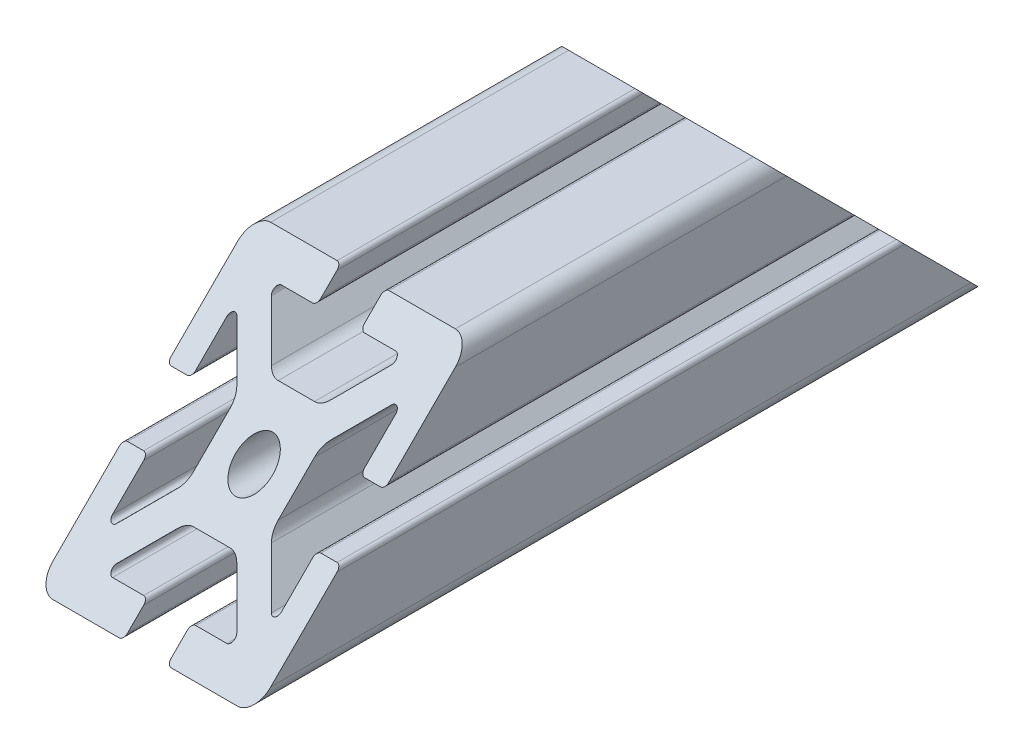
from build123d import *

# Parameters (mm, degrees)
SKETCH1_R          = 3.4036
EXTRUDE1_DEPTH     = 1219.2
CUT_EXTRUDE1_DEPTH = 1221.019934263


with BuildPart() as part:
    # Sketch1 → Extrude1 (new, symmetric)
    with BuildSketch(Plane.XY):
        with BuildLine():
            Line((-20, 16.952), (-20, 4.7625))
            ThreePointArc((-20, 4.7625), (-19.776815367, 4.223684633), (-19.238, 4.0005))
            Line((-19.238, 4.0005), (-16.2662, 4.0005))
            ThreePointArc((-16.2662, 4.0005), (-15.727384633, 4.223684633), (-15.5042, 4.7625))
            Line((-15.5042, 4.7625), (-15.5042, 10.485558599))
            ThreePointArc((-15.5042, 10.485558599), (-15.033804775, 11.189554802), (-14.203384633, 11.024373966))
            Line((-14.203384633, 11.024373966), (-8.635059555, 5.456048889))
            ThreePointArc((-8.635059555, 5.456048889), (-7.985348265, 4.483687227), (-7.7572, 3.336708444))
            Line((-7.7572, 3.336708444), (-7.7572, -3.336708444))
            ThreePointArc((-7.7572, -3.336708444), (-7.985348265, -4.483687227), (-8.635059555, -5.456048889))
            Line((-8.635059555, -5.456048889), (-14.203384633, -11.024373966))
            ThreePointArc((-14.203384633, -11.024373966), (-15.033804775, -11.189554802), (-15.5042, -10.485558599))
            Line((-15.5042, -10.485558599), (-15.5042, -4.7625))
            ThreePointArc((-15.5042, -4.7625), (-15.727384633, -4.223684633), (-16.2662, -4.0005))
            Line((-16.2662, -4.0005), (-19.238, -4.0005))
            ThreePointArc((-19.238, -4.0005), (-19.776815367, -4.223684633), (-20, -4.7625))
            Line((-20, -4.7625), (-20, -16.952))
            ThreePointArc((-20, -16.952), (-19.107261469, -19.107261469), (-16.952, -20))
            Line((-16.952, -20), (-4.7625, -20))
            ThreePointArc((-4.7625, -20), (-4.223684633, -19.776815367), (-4.0005, -19.238))
            Line((-4.0005, -19.238), (-4.0005, -16.2662))
            ThreePointArc((-4.0005, -16.2662), (-4.223684633, -15.727384633), (-4.7625, -15.5042))
            Line((-4.7625, -15.5042), (-10.485558599, -15.5042))
            ThreePointArc((-10.485558599, -15.5042), (-11.189554802, -15.033804775), (-11.024373966, -14.203384633))
            Line((-11.024373966, -14.203384633), (-5.456048889, -8.635059555))
            ThreePointArc((-5.456048889, -8.635059555), (-4.483687227, -7.985348265), (-3.336708444, -7.7572))
            Line((-3.336708444, -7.7572), (3.336708444, -7.7572))
            ThreePointArc((3.336708444, -7.7572), (4.483687227, -7.985348265), (5.456048889, -8.635059555))
            Line((5.456048889, -8.635059555), (11.024373966, -14.203384633))
            ThreePointArc((11.024373966, -14.203384633), (11.189554802, -15.033804775), (10.485558599, -15.5042))
            Line((10.485558599, -15.5042), (4.7625, -15.5042))
            ThreePointArc((4.7625, -15.5042), (4.223684633, -15.727384633), (4.0005, -16.2662))
            Line((4.0005, -16.2662), (4.0005, -19.238))
            ThreePointArc((4.0005, -19.238), (4.223684633, -19.776815367), (4.7625, -20))
            Line((4.7625, -20), (16.952, -20))
            ThreePointArc((16.952, -20), (19.107261469, -19.107261469), (20, -16.952))
            Line((20, -16.952), (20, -4.7625))
            ThreePointArc((20, -4.7625), (19.776815367, -4.223684633), (19.238, -4.0005))
            Line((19.238, -4.0005), (16.2662, -4.0005))
            ThreePointArc((16.2662, -4.0005), (15.727384633, -4.223684633), (15.5042, -4.7625))
            Line((15.5042, -4.7625), (15.5042, -10.485558599))
            ThreePointArc((15.5042, -10.485558599), (15.033804775, -11.189554802), (14.203384633, -11.024373966))
            Line((14.203384633, -11.024373966), (8.635059555, -5.456048889))
            ThreePointArc((8.635059555, -5.456048889), (7.985348265, -4.483687227), (7.7572, -3.336708444))
            Line((7.7572, -3.336708444), (7.7572, 3.336708444))
            ThreePointArc((7.7572, 3.336708444), (7.985348265, 4.483687227), (8.635059555, 5.456048889))
            Line((8.635059555, 5.456048889), (14.203384633, 11.024373966))
            ThreePointArc((14.203384633, 11.024373966), (15.033804775, 11.189554802), (15.5042, 10.485558599))
            Line((15.5042, 10.485558599), (15.5042, 4.7625))
            ThreePointArc((15.5042, 4.7625), (15.727384633, 4.223684633), (16.2662, 4.0005))
            Line((16.2662, 4.0005), (19.238, 4.0005))
            ThreePointArc((19.238, 4.0005), (19.776815367, 4.223684633), (20, 4.7625))
            Line((20, 4.7625), (20, 16.952))
            ThreePointArc((20, 16.952), (19.107261469, 19.107261469), (16.952, 20))
            Line((16.952, 20), (4.7625, 20))
            ThreePointArc((4.7625, 20), (4.223684633, 19.776815367), (4.0005, 19.238))
            Line((4.0005, 19.238), (4.0005, 16.2662))
            ThreePointArc((4.0005, 16.2662), (4.223684633, 15.727384633), (4.7625, 15.5042))
            Line((4.7625, 15.5042), (10.485558599, 15.5042))
            ThreePointArc((10.485558599, 15.5042), (11.189554802, 15.033804775), (11.024373966, 14.203384633))
            Line((11.024373966, 14.203384633), (5.456048889, 8.635059555))
            ThreePointArc((5.456048889, 8.635059555), (4.483687227, 7.985348265), (3.336708444, 7.7572))
            Line((3.336708444, 7.7572), (-3.336708444, 7.7572))
            ThreePointArc((-3.336708444, 7.7572), (-4.483687227, 7.985348265), (-5.456048889, 8.635059555))
            Line((-5.456048889, 8.635059555), (-11.024373966, 14.203384633))
            ThreePointArc((-11.024373966, 14.203384633), (-11.189554802, 15.033804775), (-10.485558599, 15.5042))
            Line((-10.485558599, 15.5042), (-4.7625, 15.5042))
            ThreePointArc((-4.7625, 15.5042), (-4.223684633, 15.727384633), (-4.0005, 16.2662))
            Line((-4.0005, 16.2662), (-4.0005, 19.238))
            ThreePointArc((-4.0005, 19.238), (-4.223684633, 19.776815367), (-4.7625, 20))
            Line((-4.7625, 20), (-16.952, 20))
            ThreePointArc((-16.952, 20), (-19.107261469, 19.107261469), (-20, 16.952))
        make_face()
        with Locations(Location((0, 0, 0), (0, 0, 180))):
            Circle(SKETCH1_R, mode=Mode.SUBTRACT)
    extrude(amount=EXTRUDE1_DEPTH, both=True)

    # Sketch2 → Cut-Extrude1 (cut, through all)
    with BuildSketch(Plane(origin=(20, 0, 0), x_dir=(0, 0, -1), z_dir=(1, 0, 0))):
        Polygon((1219.2, -20), (1179.2, 20), (1219.2, 20), align=None)
        Polygon((1124.496158184, 20), (1084.496158184, -20), (-1219.2, -20), (-1219.2, 20), align=None)
    extrude(amount=-CUT_EXTRUDE1_DEPTH, mode=Mode.SUBTRACT)


solid = part.part
